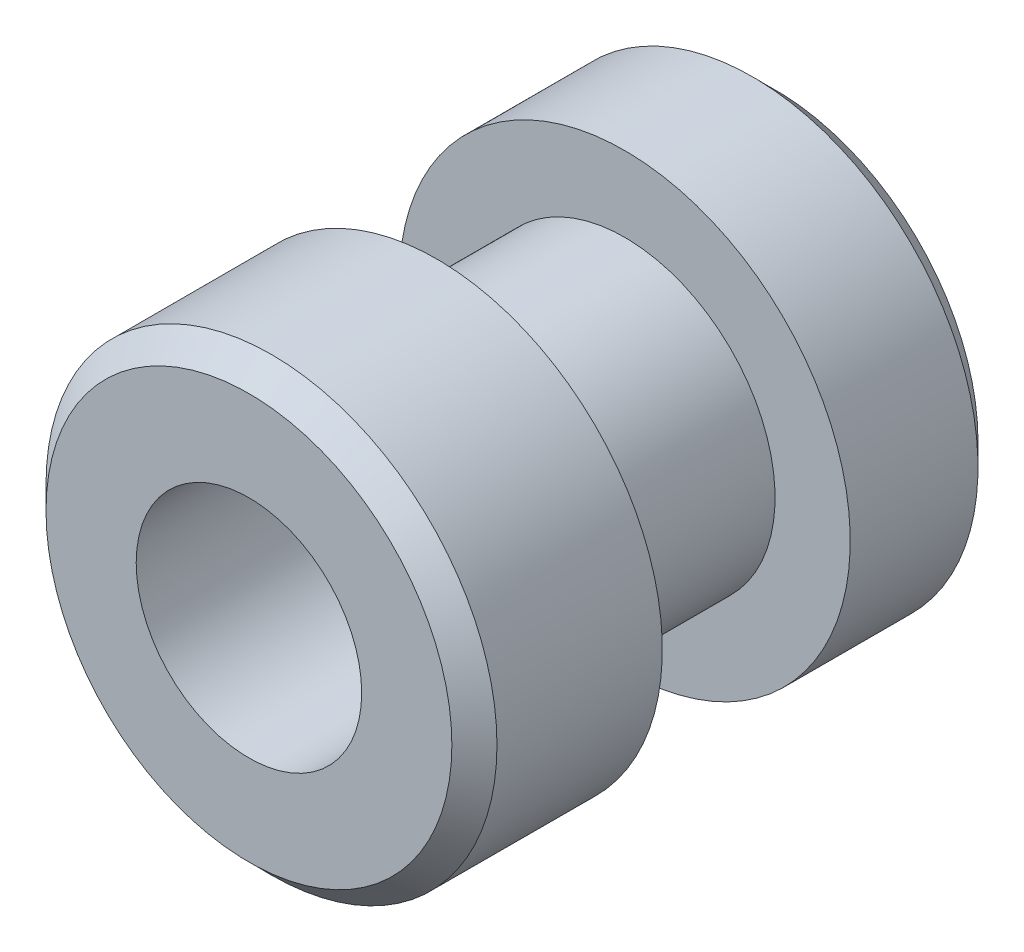
from build123d import *

# Parameters (mm, degrees)
CHAMFER_1_SIZE = 0.3


with BuildPart() as part:
    # 草图2 → 旋转1 (revolve)
    with BuildSketch(Plane(origin=(0, 0, 0), x_dir=(1, 0, 0), z_dir=(0, 1, 0))):
        Polygon((-1.5, 7), (-3, 7), (-3, 5), (-2, 5), (-2, 2.5), (-3, 2.5), (-3, 0), (-1.5, 0), align=None)
    revolve(axis=Axis((0, 0, -2.413034418), (0, 0, 1)))

    # 倒角1
    chamfer_1_edges = [part.edges().sort_by_distance(p)[0] for p in [
        (3, 0, 0),
        (3, 0, -7),
    ]]
    chamfer(chamfer_1_edges, length=CHAMFER_1_SIZE)


solid = part.part
